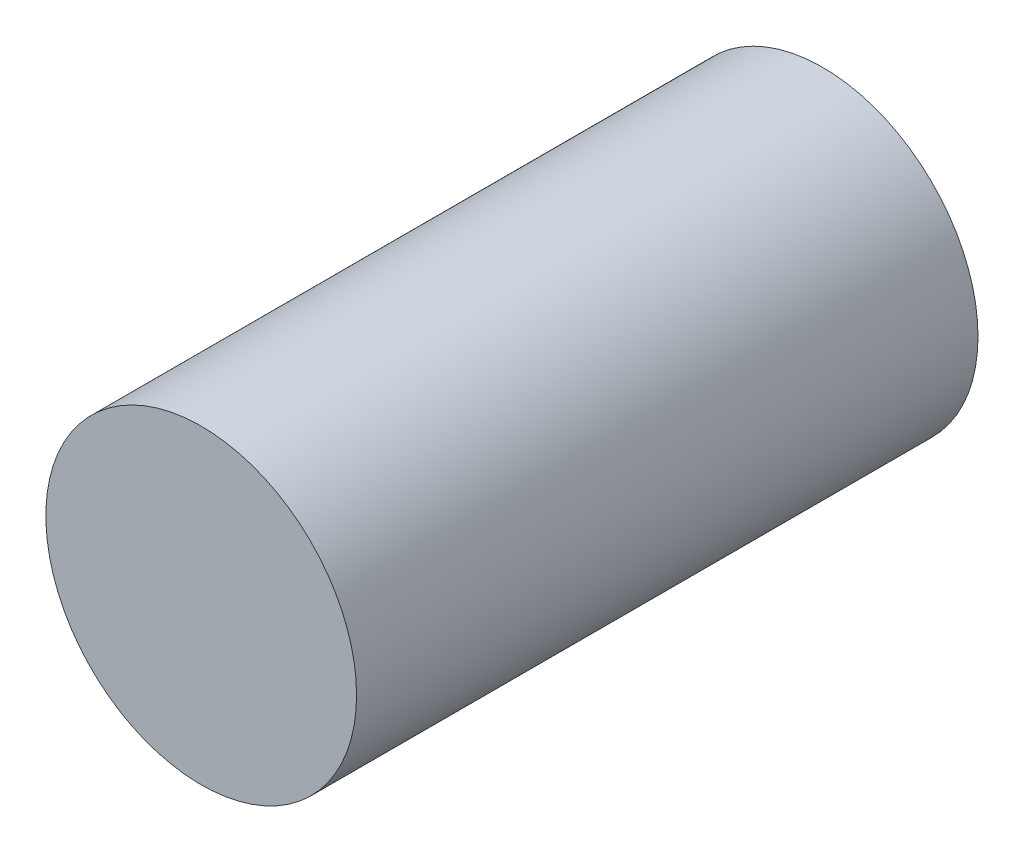
from build123d import *

# Parameters (mm, degrees)
SKETCH_1_R      = 10
EXTRUDE_1_DEPTH = 40


with BuildPart() as part:
    # Эскиз1 → Бобышка-Вытянуть1 (new body)
    with BuildSketch(Plane.XY):
        Circle(SKETCH_1_R)
    extrude(amount=EXTRUDE_1_DEPTH)


solid = part.part
